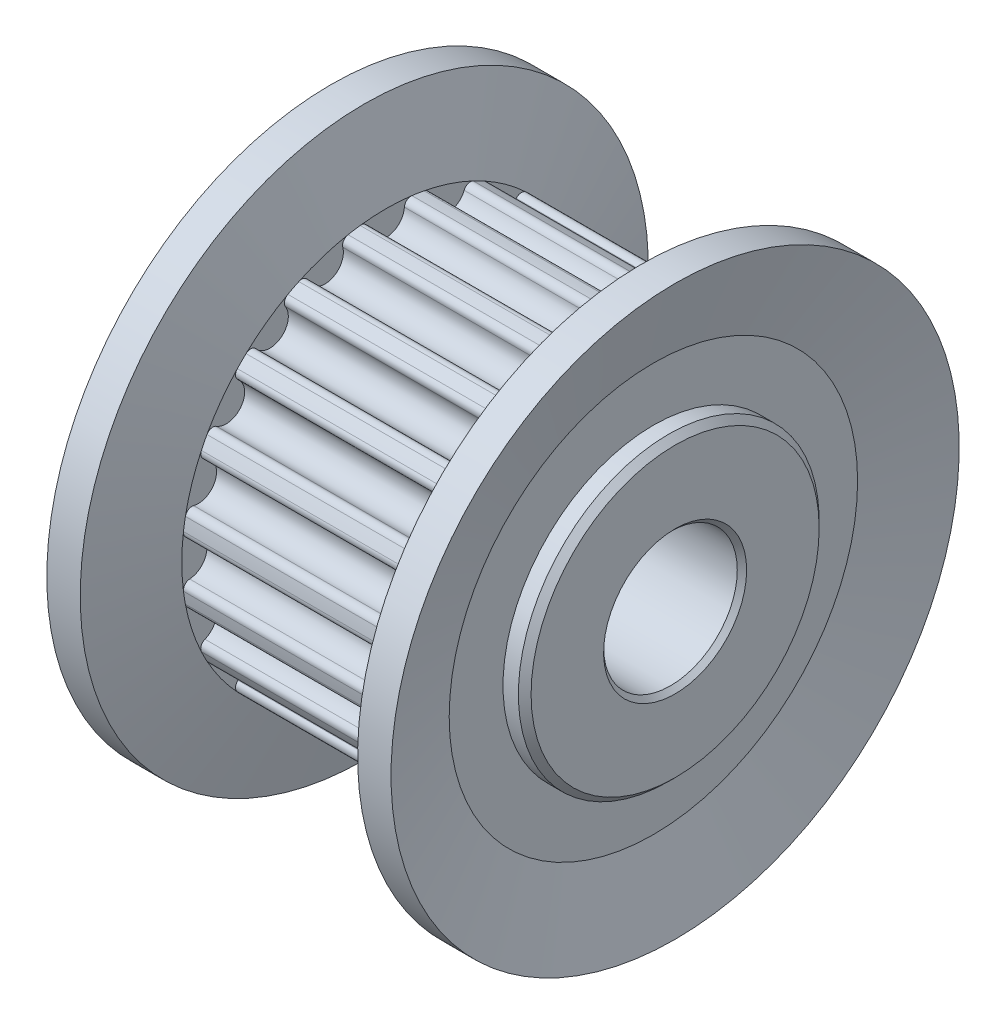
from build123d import *

# Parameters (mm, degrees)
CUT_EXTRUDE_START        = 8.65
CUT_EXTRUDE_1_DEPTH      = 7
PATTERN_CIRCULAR_1_COUNT = 20
SKETCH_6_R               = 2
CUT_EXTRUDE_2_DEPTH      = 16.830034744
CHAMFER_1_SIZE           = 0.14


with BuildPart() as part:
    # 草图3 → 旋转1 (revolve)
    with BuildSketch(Plane.XY):
        Polygon((0, 0), (0, 4.31), (0.19, 4.5), (1.65, 4.5), (1.65, 6.11), (8.65, 6.11), (8.65, 4.5), (10.11, 4.5), (10.3, 4.31), (10.3, 0), align=None)
    revolve(axis=Axis((10.3, 0, 0), (-1, 0, 0)))

    # 草图4 → 切除-拉伸1 (cut)
    with BuildSketch(Plane(origin=(0, 0, 0), x_dir=(0, 0, -1), z_dir=(1, 0, 0)).offset(CUT_EXTRUDE_START)):
        with BuildLine():
            ThreePointArc((0.773818245, 6.060800716), (0, 6.11), (-0.773818245, 6.060800716))
            ThreePointArc((-0.773818245, 6.060800716), (-0.621157102, 6.016640443), (-0.548891698, 5.875101523))
            ThreePointArc((-0.548891698, 5.875101523), (0, 5.36), (0.548891698, 5.875101523))
            ThreePointArc((0.548891698, 5.875101523), (0.621157102, 6.016640443), (0.773818245, 6.060800716))
        make_face()
    cut_extrude_1 = extrude(amount=-CUT_EXTRUDE_1_DEPTH, mode=Mode.SUBTRACT)

    # 阵列(圆周)1: 切除-拉伸1 ×20 about axis
    pattern_circular_1_axis = Axis((0, 0, 0), (1, 0, 0))
    for i in range(1, PATTERN_CIRCULAR_1_COUNT):
        add(cut_extrude_1.rotate(pattern_circular_1_axis, i * 360 / PATTERN_CIRCULAR_1_COUNT), mode=Mode.SUBTRACT)

    # 草图5 → 旋转2 (revolve)
    with BuildSketch(Plane.XY, mode=Mode.PRIVATE) as revolve_2_sk:
        Polygon((1, 8.5), (1.65, 6.11), (1.65, 4.5), (0.65, 4.5), (0.65, 6.11), (0, 8.5), align=None)
        Polygon((9.65, 4.5), (8.65, 4.5), (8.65, 6.11), (9.3, 8.5), (10.3, 8.5), (9.65, 6.11), align=None)
    revolve(revolve_2_sk.sketch.rotate(Axis((0, 0, 0), (1, 0, 0)), 180), axis=Axis((0, 0, 0), (1, 0, 0)))

    # 草图6 → 切除-拉伸2 (cut, through all)
    with BuildSketch(Plane(origin=(0, 0, 0), x_dir=(0, 0, -1), z_dir=(1, 0, 0))):
        Circle(SKETCH_6_R)
    extrude(amount=CUT_EXTRUDE_2_DEPTH, mode=Mode.SUBTRACT)

    # 倒角1
    chamfer_1_edges = [part.edges().sort_by_distance(p)[0] for p in [
        (0, 0, 2),
        (10.3, 0, 2),
    ]]
    chamfer(chamfer_1_edges, length=CHAMFER_1_SIZE)


solid = part.part
